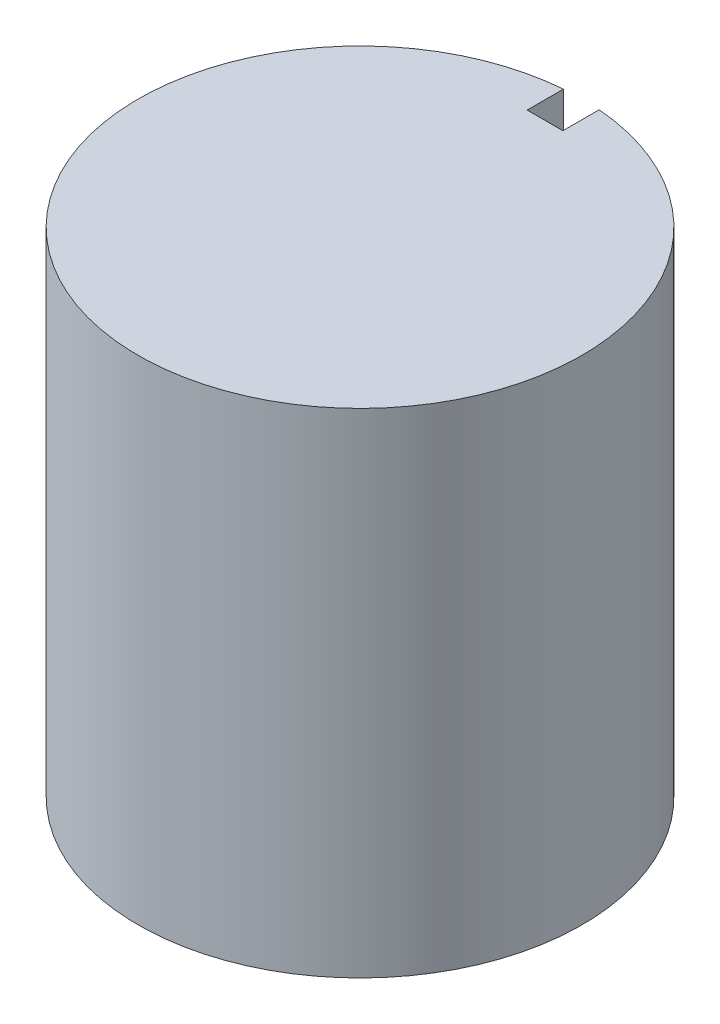
from build123d import *

# Parameters (mm, degrees)
BOSS_EXTRUDE1_DEPTH = 40


with BuildPart() as part:
    # Sketch1 → Boss-Extrude1 (new body)
    with BuildSketch(Plane(origin=(0, 0, 0), x_dir=(1, 0, 0), z_dir=(0, 1, 0))):
        with BuildLine():
            Line((1.45, 17.941502167), (1.45, 15))
            Line((1.45, 15), (-1.45, 15))
            Line((-1.45, 15), (-1.45, 17.941502167))
            ThreePointArc((-1.45, 17.941502167), (-12.204507364, -13.230646243), (18, 0))
            ThreePointArc((18, 0), (13.230646243, 12.204507364), (1.45, 17.941502167))
        make_face()
    extrude(amount=BOSS_EXTRUDE1_DEPTH)


solid = part.part
